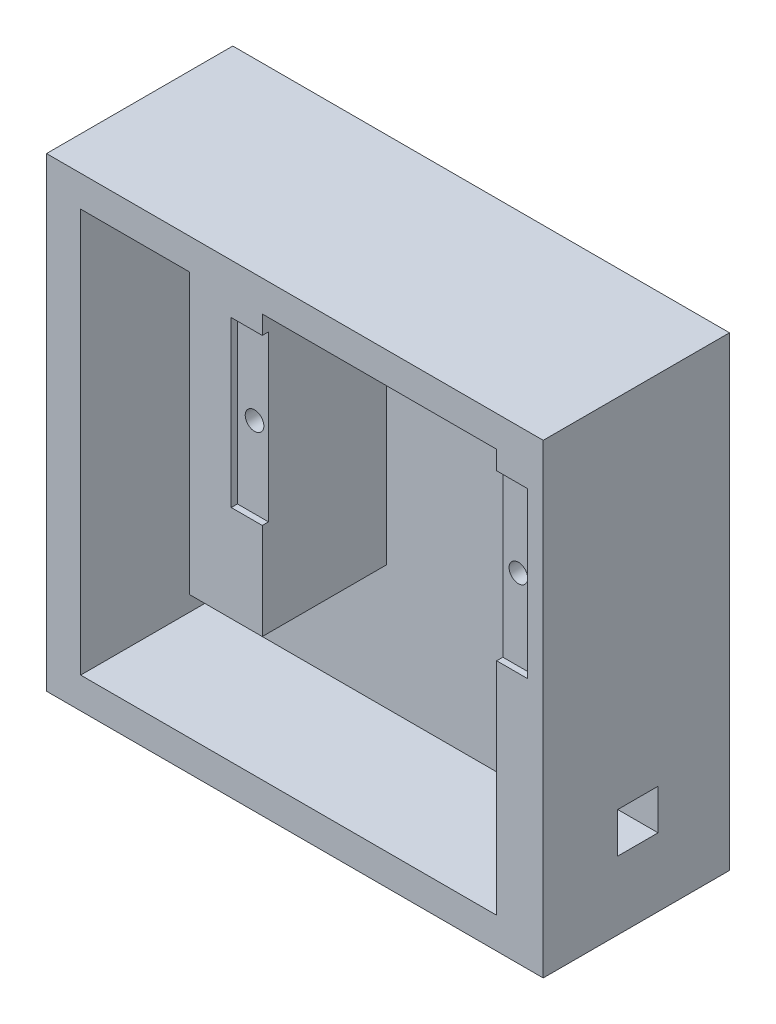
from build123d import *

# Parameters (mm, degrees)
SKETCH2_W           = 160
SKETCH2_H           = 150
BOSS_EXTRUDE1_DEPTH = 60
CUT_EXTRUDE1_DEPTH  = 40
SKETCH4_R           = 3
CUT_EXTRUDE2_DEPTH  = 60
SKETCH5_W           = 13
SKETCH5_H           = 13
CUT_EXTRUDE3_DEPTH  = 50
SKETCH6_W           = 10
SKETCH6_H           = 53
CUT_EXTRUDE4_DEPTH  = 2
SKETCH7_W           = 35
SKETCH7_H           = 130
CUT_EXTRUDE5_DEPTH  = 40


with BuildPart() as part:
    # Sketch2 → Boss-Extrude1 (new body)
    with BuildSketch(Plane.XY):
        with Locations((-80, -75)):
            Rectangle(SKETCH2_W, SKETCH2_H)
    extrude(amount=BOSS_EXTRUDE1_DEPTH)

    # Sketch3 → Cut-Extrude1 (cut)
    with BuildSketch(Plane.XY.offset(60)):
        Polygon((-90.5, -10), (-15, -10), (-15, -140), (-149, -140), (-149, -100), (-90.5, -100), align=None)
    extrude(amount=-CUT_EXTRUDE1_DEPTH, mode=Mode.SUBTRACT)

    # Sketch4 → Cut-Extrude2 (cut)
    with BuildSketch(Plane.XY.offset(60)):
        with Locations((-95, -43)):
            Circle(SKETCH4_R)
        with Locations((-10, -43)):
            Circle(SKETCH4_R)
    extrude(amount=-CUT_EXTRUDE2_DEPTH, mode=Mode.SUBTRACT)

    # Sketch5 → Cut-Extrude3 (cut)
    with BuildSketch(Plane(origin=(0, 0, 0), x_dir=(0, 0, -1), z_dir=(1, 0, 0))):
        with Locations((-29.5, -121.5)):
            Rectangle(SKETCH5_W, SKETCH5_H)
    extrude(amount=-CUT_EXTRUDE3_DEPTH, mode=Mode.SUBTRACT)

    # Sketch6 → Cut-Extrude4 (cut)
    with BuildSketch(Plane.XY.offset(60)):
        with Locations((-95.5, -42.5)):
            Rectangle(SKETCH6_W, SKETCH6_H)
        with Locations((-10, -42.5)):
            Rectangle(SKETCH6_W, SKETCH6_H)
    extrude(amount=-CUT_EXTRUDE4_DEPTH, mode=Mode.SUBTRACT)

    # Sketch7 → Cut-Extrude5 (cut)
    with BuildSketch(Plane.XY.offset(60)):
        with Locations((-131.5, -75)):
            Rectangle(SKETCH7_W, SKETCH7_H)
    extrude(amount=-CUT_EXTRUDE5_DEPTH, mode=Mode.SUBTRACT)


solid = part.part
